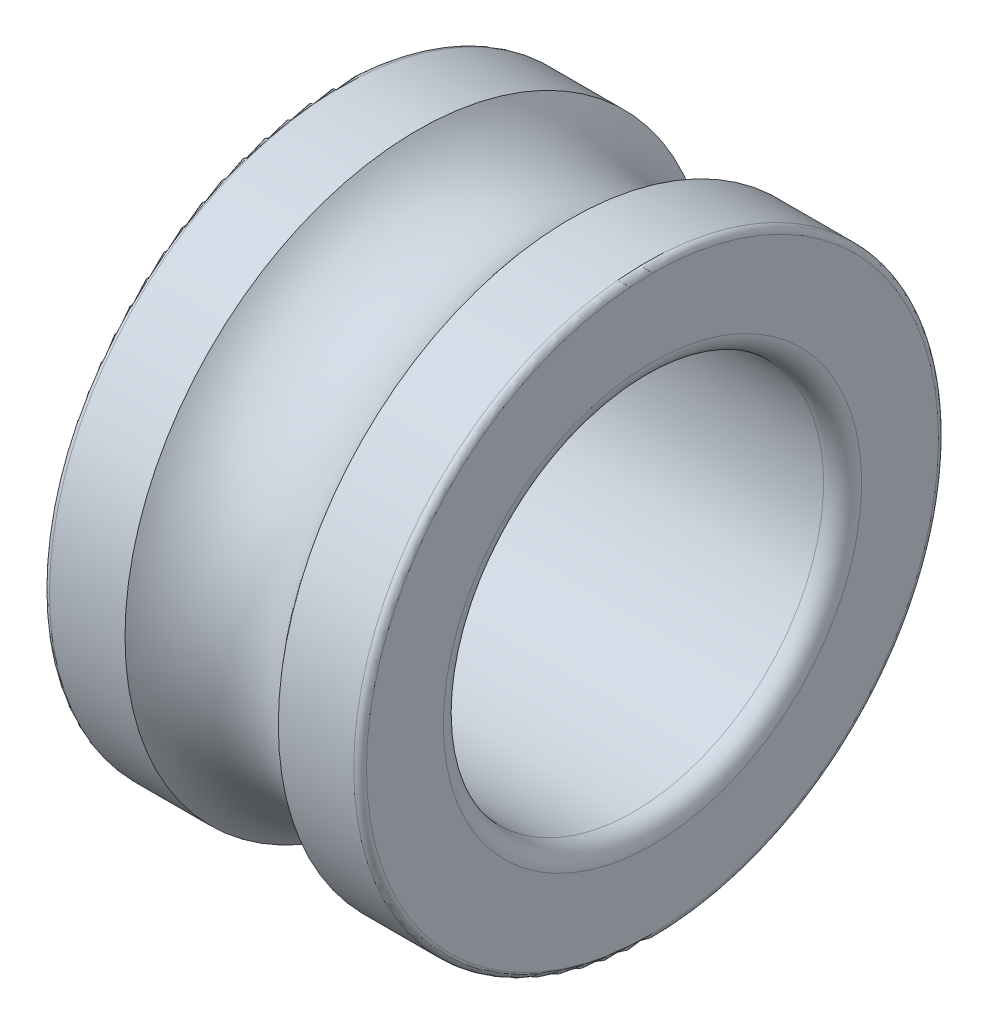
from build123d import *


with BuildPart() as part:
    # Esquisse1 → Révolution1 (revolve)
    with BuildSketch(Plane.XY, mode=Mode.PRIVATE) as r_volution1_sk:
        with BuildLine():
            Line((0.6, 6), (9.4, 6))
            ThreePointArc((9.4, 6), (9.824264069, 6.175735931), (10, 6.6))
            Line((10, 6.6), (10, 9.025))
            ThreePointArc((10, 9.025), (9.941421356, 9.166421356), (9.8, 9.225))
            Line((9.8, 9.225), (7.418548118, 9.225))
            ThreePointArc((7.418548118, 9.225), (5, 8), (2.581451882, 9.225))
            Line((2.581451882, 9.225), (0.2, 9.225))
            ThreePointArc((0.2, 9.225), (0.058578644, 9.166421356), (0, 9.025))
            Line((0, 9.025), (0, 6.6))
            ThreePointArc((0, 6.6), (0.175735931, 6.175735931), (0.6, 6))
        make_face()
    revolve(r_volution1_sk.sketch.rotate(Axis((100, 0, 0), (-1, 0, 0)), 270), axis=Axis((100, 0, 0), (-1, 0, 0)))


solid = part.part
